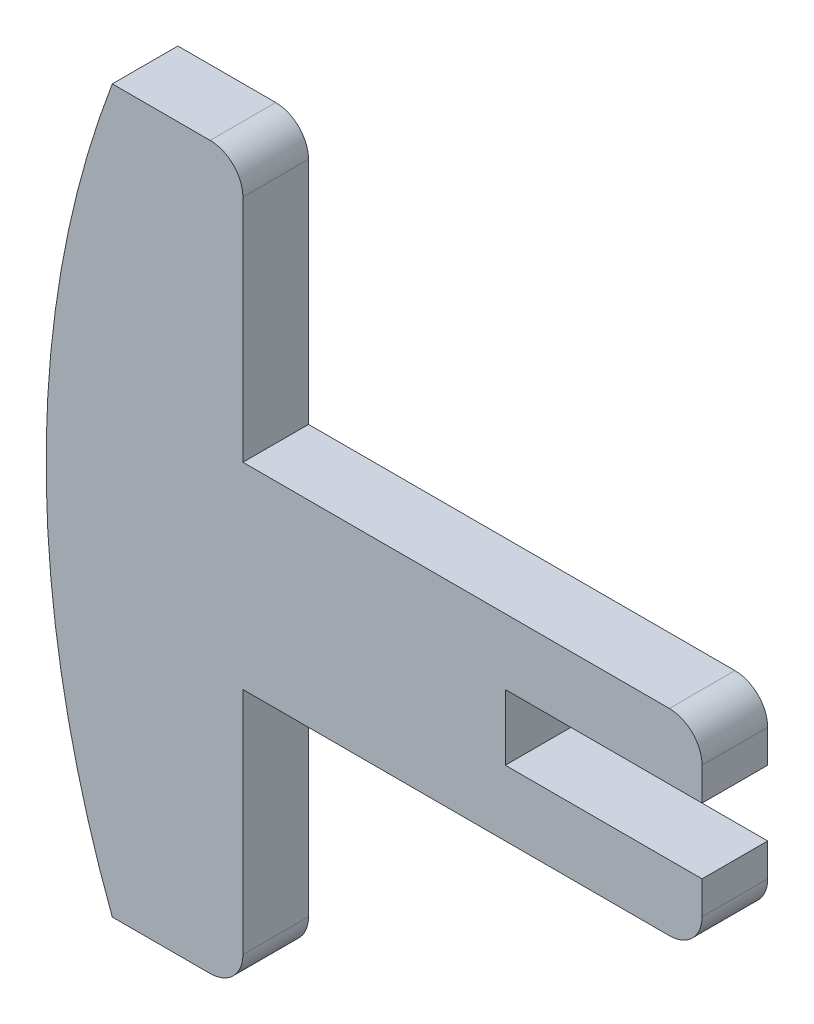
from build123d import *

# Parameters (mm, degrees)
BOSS_EXTRUDE1_DEPTH = 2


with BuildPart() as part:
    # Sketch1 → Boss-Extrude1 (new body)
    with BuildSketch(Plane.XY):
        with BuildLine():
            Line((-24.999999472, 3), (-12, 3))
            ThreePointArc((-12, 3), (-11.292893219, 2.707106781), (-11, 2))
            Line((-11, 2), (-11, 1))
            Line((-11, 1), (-17, 1))
            Line((-17, 1), (-17, -1))
            Line((-17, -1), (-11, -1))
            Line((-11, -1), (-11, -2))
            ThreePointArc((-11, -2), (-11.292893219, -2.707106781), (-12, -3))
            Line((-12, -3), (-24.999999472, -3))
            Line((-24.999999472, -3), (-24.999999472, -10))
            ThreePointArc((-24.999999472, -10), (-25.292892691, -10.707106781), (-25.999999472, -11))
            Line((-25.999999472, -11), (-28.982753492, -11))
            ThreePointArc((-28.982753492, -11), (-31, 0), (-28.982753492, 11))
            Line((-28.982753492, 11), (-25.999999472, 11))
            ThreePointArc((-25.999999472, 11), (-25.292892691, 10.707106781), (-24.999999472, 10))
            Line((-24.999999472, 10), (-24.999999472, 3))
        make_face()
    extrude(amount=BOSS_EXTRUDE1_DEPTH)


solid = part.part
